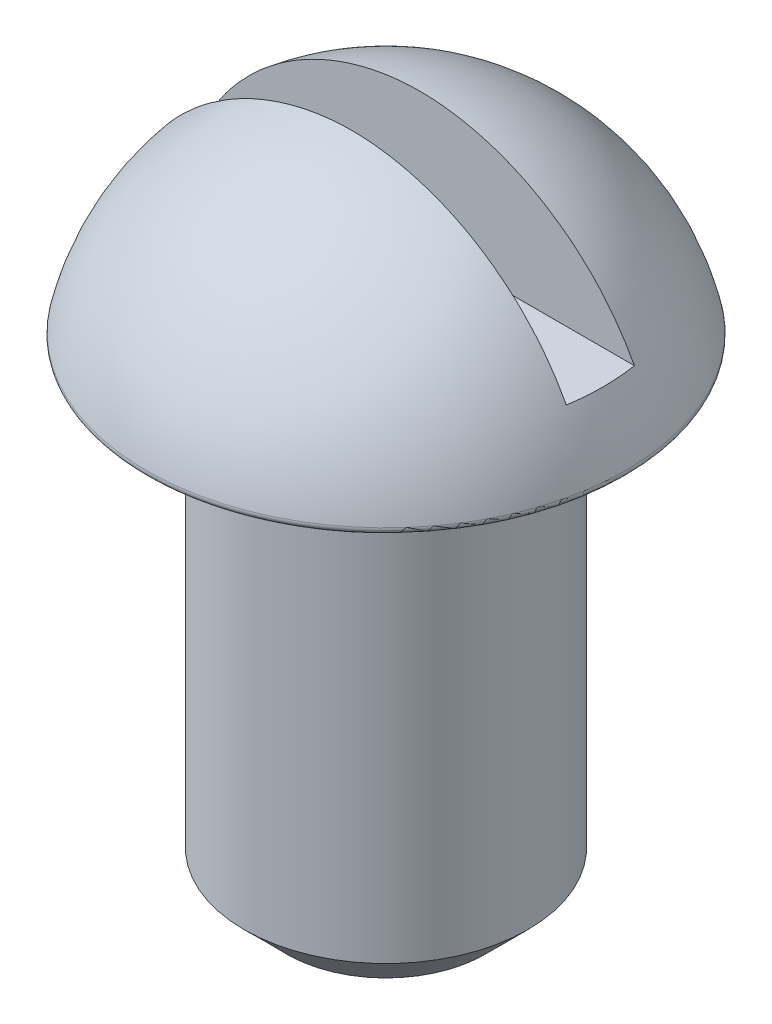
from build123d import *

# Parameters (mm, degrees)
SKETCH_13_W         = 8.5
SKETCH_13_H         = 1.2
CUT_EXTRUDE_9_DEPTH = 2.3
FILLET_1_R          = 0.1
CHAMFER_1_SIZE      = 0.75


with BuildPart() as part:
    # Эскиз1 → Повернуть1 (revolve)
    with BuildSketch(Plane.XY):
        with BuildLine():
            Line((2.5, 90.74931314), (4.25, 90.74931314))
            ThreePointArc((4.25, 90.74931314), (2.978035275, 93.076049927), (0.6, 94.24931314))
            Line((0.6, 94.24931314), (0, 94.24931314))
            Line((0, 94.24931314), (0, 82.24931314))
            Line((0, 82.24931314), (2.5, 82.24931314))
            Line((2.5, 82.24931314), (2.5, 90.74931314))
        make_face()
    revolve(axis=Axis((0, 125.763182898, 0), (0, -1, 0)))

    # Эскиз13 → Вырез-Вытянуть9 (cut)
    with BuildSketch(Plane(origin=(0, 94.24931314, 0), x_dir=(-1, 0, 0), z_dir=(0, 1, 0))):
        Rectangle(SKETCH_13_W, SKETCH_13_H)
    extrude(amount=-CUT_EXTRUDE_9_DEPTH, mode=Mode.SUBTRACT)

    # Скругление1
    fillet_1_edges = [part.edges().sort_by_distance(p)[0] for p in [
        (-4.25, 90.74931314, 0),
    ]]
    fillet(fillet_1_edges, radius=FILLET_1_R)

    # Фаска1
    chamfer_1_edges = [part.edges().sort_by_distance(p)[0] for p in [
        (-2.5, 82.24931314, 0),
    ]]
    chamfer(chamfer_1_edges, length=CHAMFER_1_SIZE)


solid = part.part
